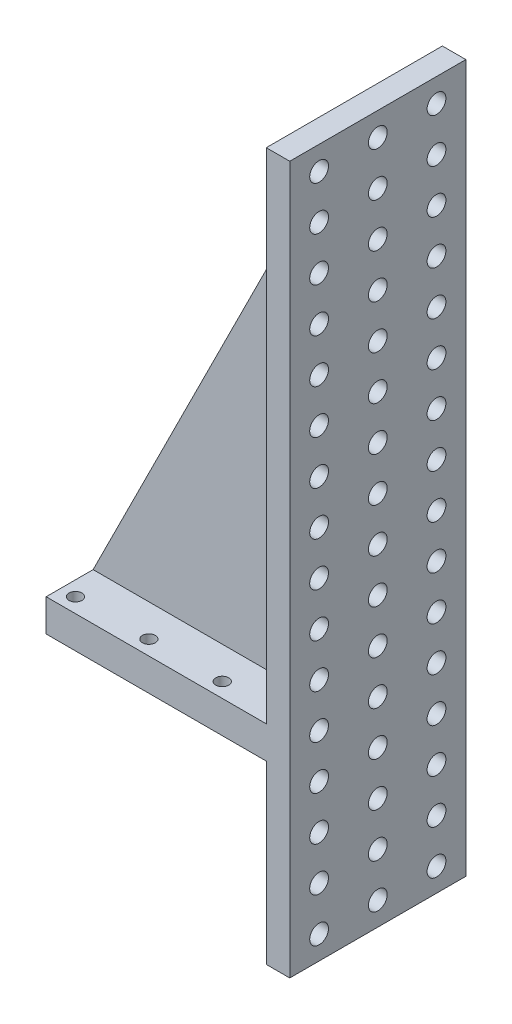
from build123d import *

# Parameters (mm, degrees)
SKETCH1_W           = 75
SKETCH1_H           = 60
SKETCH1_R           = 2.2
BOSS_EXTRUDE1_DEPTH = 11
SKETCH2_W           = 60
SKETCH2_H           = 241
BOSS_EXTRUDE2_DEPTH = 8
SKETCH4_W           = 75
SKETCH4_H           = 6
BOSS_EXTRUDE3_DEPTH = 150
CUT_EXTRUDE1_DEPTH  = 28
SKETCH6_R           = 3.2
CUT_EXTRUDE2_DEPTH  = 8


with BuildPart() as part:
    # Sketch1 → Boss-Extrude1 (new body)
    with BuildSketch(Plane(origin=(0, 0, 0), x_dir=(1, 0, 0), z_dir=(0, 1, 0))):
        Rectangle(SKETCH1_W, SKETCH1_H)
        with Locations(Location((-7.5, 25, 0), (0, 0, 270))):
            Circle(SKETCH1_R, mode=Mode.SUBTRACT)
        with Locations(Location((-7.5, -25, 0), (0, 0, 270))):
            Circle(SKETCH1_R, mode=Mode.SUBTRACT)
        with Locations(Location((17.5, 25, 0), (0, 0, 270))):
            Circle(SKETCH1_R, mode=Mode.SUBTRACT)
        with Locations(Location((17.5, 0, 0), (0, 0, 270))):
            Circle(SKETCH1_R, mode=Mode.SUBTRACT)
        with Locations(Location((17.5, -25, 0), (0, 0, 270))):
            Circle(SKETCH1_R, mode=Mode.SUBTRACT)
        with Locations(Location((-32.5, 25, 0), (0, 0, 270))):
            Circle(SKETCH1_R, mode=Mode.SUBTRACT)
        with Locations(Location((-32.5, 0, 0), (0, 0, 270))):
            Circle(SKETCH1_R, mode=Mode.SUBTRACT)
        with Locations(Location((-32.5, -25, 0), (0, 0, 270))):
            Circle(SKETCH1_R, mode=Mode.SUBTRACT)
        with Locations(Location((-7.5, 0, 0), (0, 0, 270))):
            Circle(SKETCH1_R, mode=Mode.SUBTRACT)
    extrude(amount=BOSS_EXTRUDE1_DEPTH)

    # Sketch2 → Boss-Extrude2 (add)
    with BuildSketch(Plane(origin=(37.5, 0, 0), x_dir=(0, 0, -1), z_dir=(1, 0, 0))):
        with Locations((0, 60.5)):
            Rectangle(SKETCH2_W, SKETCH2_H)
    extrude(amount=BOSS_EXTRUDE2_DEPTH)

    # Sketch4 → Boss-Extrude3 (add)
    with BuildSketch(Plane(origin=(0, 11, 0), x_dir=(1, 0, 0), z_dir=(0, 1, 0))):
        with Locations((0, 11)):
            Rectangle(SKETCH4_W, SKETCH4_H)
        with Locations((0, -11)):
            Rectangle(SKETCH4_W, SKETCH4_H)
    extrude(amount=BOSS_EXTRUDE3_DEPTH)

    # Sketch5 → Cut-Extrude1 (cut)
    with BuildSketch(Plane.XY.offset(14)):
        Polygon((37.5, 161), (-37.5, 161), (-37.5, 11), align=None)
    extrude(amount=-CUT_EXTRUDE1_DEPTH, mode=Mode.SUBTRACT)

    # Sketch6 → Cut-Extrude2 (cut)
    with BuildSketch(Plane(origin=(45.5, 0, 0), x_dir=(0, 0, -1), z_dir=(1, 0, 0))):
        with Locations((-20, 173)):
            Circle(SKETCH6_R)
        with Locations((0, 173)):
            Circle(SKETCH6_R)
        with Locations((20, 173)):
            Circle(SKETCH6_R)
        with Locations((0, 158)):
            Circle(SKETCH6_R)
        with Locations((-20, 158)):
            Circle(SKETCH6_R)
        with Locations((20, 158)):
            Circle(SKETCH6_R)
        with Locations((-20, 143)):
            Circle(SKETCH6_R)
        with Locations((0, 143)):
            Circle(SKETCH6_R)
        with Locations((20, 143)):
            Circle(SKETCH6_R)
        with Locations((-20, 128)):
            Circle(SKETCH6_R)
        with Locations((0, 128)):
            Circle(SKETCH6_R)
        with Locations((20, 128)):
            Circle(SKETCH6_R)
        with Locations((-20, 113)):
            Circle(SKETCH6_R)
        with Locations((0, 113)):
            Circle(SKETCH6_R)
        with Locations((20, 113)):
            Circle(SKETCH6_R)
        with Locations((20, 98)):
            Circle(SKETCH6_R)
        with Locations((0, 98)):
            Circle(SKETCH6_R)
        with Locations((-20, 98)):
            Circle(SKETCH6_R)
        with Locations((-20, 83)):
            Circle(SKETCH6_R)
        with Locations((0, 83)):
            Circle(SKETCH6_R)
        with Locations((20, 83)):
            Circle(SKETCH6_R)
        with Locations((20, 68)):
            Circle(SKETCH6_R)
        with Locations((0, 68)):
            Circle(SKETCH6_R)
        with Locations((-20, 68)):
            Circle(SKETCH6_R)
        with Locations((-20, 53)):
            Circle(SKETCH6_R)
        with Locations((0, 53)):
            Circle(SKETCH6_R)
        with Locations((20, 53)):
            Circle(SKETCH6_R)
        with Locations((20, 38)):
            Circle(SKETCH6_R)
        with Locations((0, 38)):
            Circle(SKETCH6_R)
        with Locations((-20, 38)):
            Circle(SKETCH6_R)
        with Locations((-20, 23)):
            Circle(SKETCH6_R)
        with Locations((0, 23)):
            Circle(SKETCH6_R)
        with Locations((20, 23)):
            Circle(SKETCH6_R)
        with Locations((20, 8)):
            Circle(SKETCH6_R)
        with Locations((-20, 8)):
            Circle(SKETCH6_R)
        with Locations((0, 8)):
            Circle(SKETCH6_R)
        with Locations((-20, -7)):
            Circle(SKETCH6_R)
        with Locations((0, -7)):
            Circle(SKETCH6_R)
        with Locations((20, -7)):
            Circle(SKETCH6_R)
        with Locations((20, -22)):
            Circle(SKETCH6_R)
        with Locations((0, -22)):
            Circle(SKETCH6_R)
        with Locations((-20, -22)):
            Circle(SKETCH6_R)
        with Locations((-20, -37)):
            Circle(SKETCH6_R)
        with Locations((0, -37)):
            Circle(SKETCH6_R)
        with Locations((20, -37)):
            Circle(SKETCH6_R)
        with Locations((20, -52)):
            Circle(SKETCH6_R)
        with Locations((0, -52)):
            Circle(SKETCH6_R)
        with Locations((-20, -52)):
            Circle(SKETCH6_R)
    extrude(amount=-CUT_EXTRUDE2_DEPTH, mode=Mode.SUBTRACT)


solid = part.part
